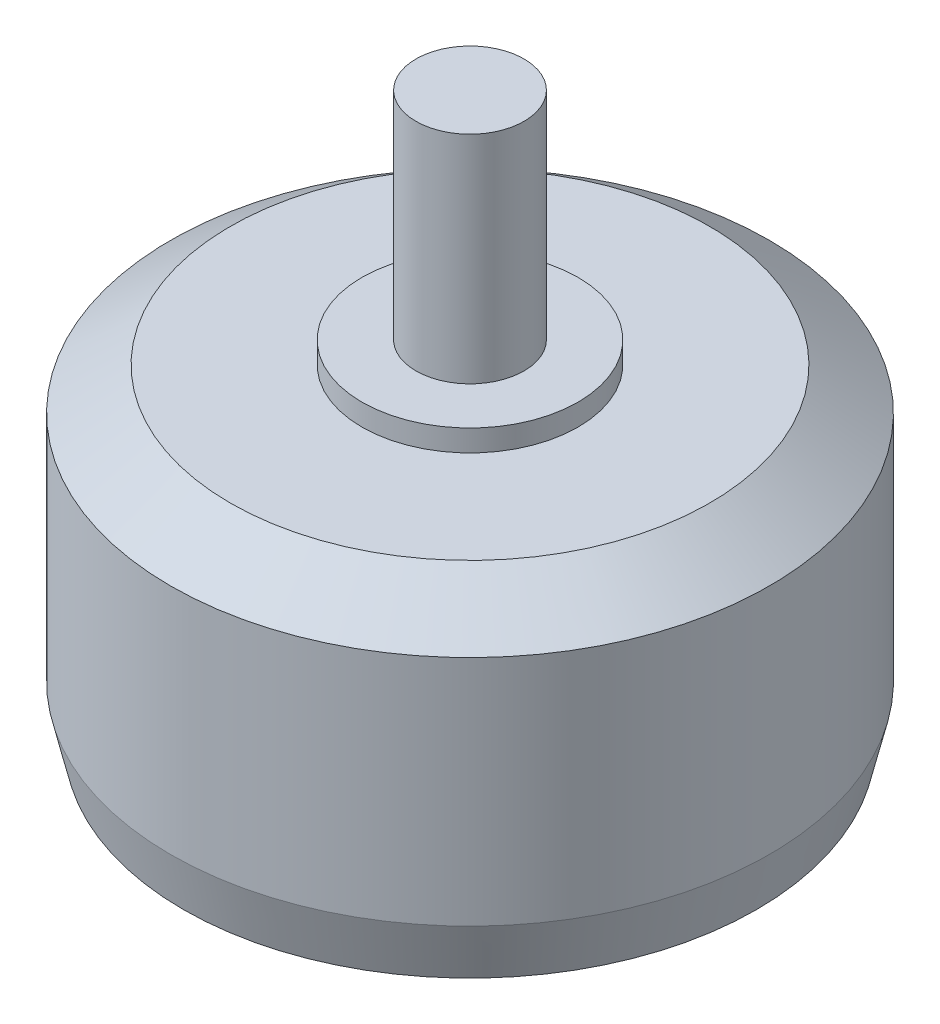
from build123d import *

# Parameters (mm, degrees)
SKETCH2_R          = 1
CUT_EXTRUDE1_DEPTH = 10.16


with BuildPart() as part:
    # Sketch1 → Revolve1 (revolve)
    with BuildSketch(Plane(origin=(0, 0, 0), x_dir=(0, 0, -1), z_dir=(1, 0, 0))):
        Polygon((0, 0), (-13.257279683, 0), (-13.85, 2.503549111), (-13.85, 13.261063329), (-11.086941731, 15.2), (-5, 15.2), (-5, 16.2), (-2.5, 16.2), (-2.5, 26.2), (0, 26.2), align=None)
    revolve(axis=Axis((0, 26.2, 0), (0, -1, 0)))

    # Sketch2 → Cut-Extrude1 (cut)
    with BuildSketch(Plane.XZ):
        with Locations(Location((0, 6, 0), (0, 0, 270))):
            Circle(SKETCH2_R)
        with Locations(Location((8, 0, 0), (0, 0, 270))):
            Circle(SKETCH2_R)
        with Locations(Location((0, -6, 0), (0, 0, 270))):
            Circle(SKETCH2_R)
        with Locations(Location((-8, 0, 0), (0, 0, 270))):
            Circle(SKETCH2_R)
    extrude(amount=-CUT_EXTRUDE1_DEPTH, mode=Mode.SUBTRACT)


solid = part.part
